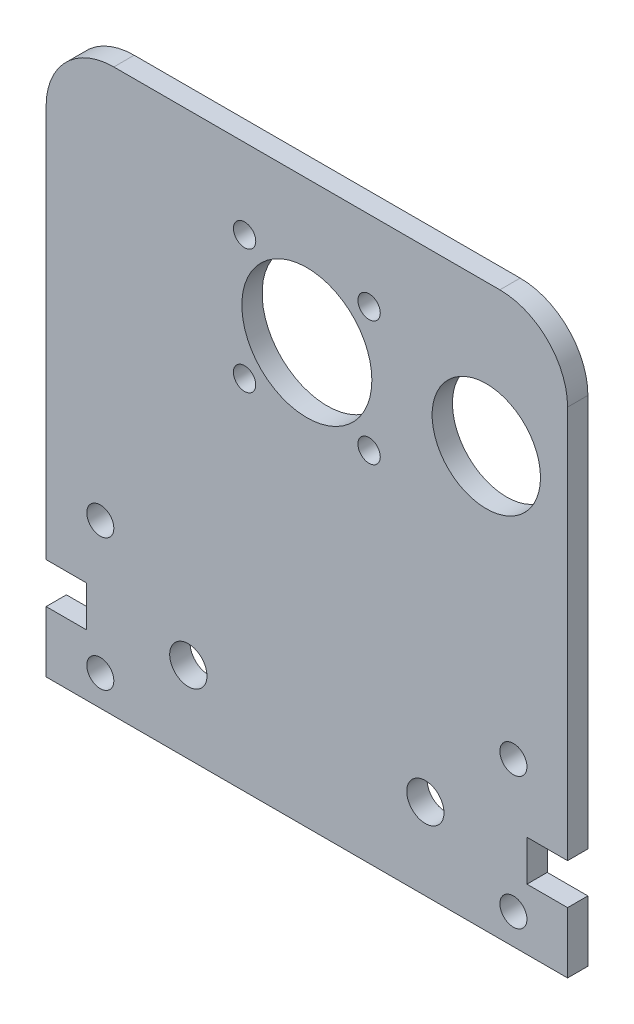
from build123d import *

# Parameters (mm, degrees)
SKETCH1_W           = 77
SKETCH1_H           = 65
BOSS_EXTRUDE1_DEPTH = 3
SKETCH2_R           = 2.75
CUT_EXTRUDE1_DEPTH  = 109.935760887
SKETCH3_R           = 1.65
SKETCH3_R_2         = 9.6
CUT_EXTRUDE2_DEPTH  = 109.935760887
FILLET1_R           = 10
SKETCH4_W           = 77
SKETCH4_H           = 6
BOSS_EXTRUDE2_DEPTH = 3
SKETCH5_R           = 2
CUT_EXTRUDE3_DEPTH  = 109.935760887
SKETCH6_R           = 8
SKETCH6_R_2         = 2.5
CUT_EXTRUDE4_DEPTH  = 109.935760887


with BuildPart() as part:
    # Sketch1 → Boss-Extrude1 (new body)
    with BuildSketch(Plane.XY):
        with Locations((38.5, 44.5)):
            Rectangle(SKETCH1_W, SKETCH1_H)
        Polygon((77, 12), (38.5, 12), (38.5, 0), (77, 0), (77, 3), (71, 3), (71, 9), (77, 9), align=None)
        Polygon((38.5, 0), (38.5, 12), (0, 12), (0, 9), (6, 9), (6, 3), (0, 3), (0, 0), align=None)
    extrude(amount=BOSS_EXTRUDE1_DEPTH)

    # Sketch2 → Cut-Extrude1 (cut, through all)
    with BuildSketch(Plane.XY.offset(3)):
        with Locations((21, 6)):
            Circle(SKETCH2_R)
        with Locations((56, 6)):
            Circle(SKETCH2_R)
    extrude(amount=-CUT_EXTRUDE1_DEPTH, mode=Mode.SUBTRACT)

    # Sketch3 → Cut-Extrude2 (cut, through all)
    with BuildSketch(Plane.XY.offset(3)):
        with Locations((29.307611845, 46.807611845)):
            Circle(SKETCH3_R)
        with Locations((47.692388155, 46.807611845)):
            Circle(SKETCH3_R)
        with Locations((47.692388155, 65.192388155)):
            Circle(SKETCH3_R)
        with Locations((29.307611845, 65.192388155)):
            Circle(SKETCH3_R)
        with Locations((38.5, 56)):
            Circle(SKETCH3_R_2)
    extrude(amount=-CUT_EXTRUDE2_DEPTH, mode=Mode.SUBTRACT)

    # Fillet1
    fillet1_edges = [part.edges().sort_by_distance(p)[0] for p in [
        (0, 77, 1.5),
        (77, 77, 1.5),
    ]]
    fillet(fillet1_edges, radius=FILLET1_R)

    # Sketch4 → Boss-Extrude2 (add)
    with BuildSketch(Plane.XY.offset(3)):
        with Locations((38.5, -3)):
            Rectangle(SKETCH4_W, SKETCH4_H)
    extrude(amount=-BOSS_EXTRUDE2_DEPTH)

    # Sketch5 → Cut-Extrude3 (cut, through all)
    with BuildSketch(Plane.XY.offset(3)):
        with Locations((8, -1.5)):
            Circle(SKETCH5_R)
        with Locations((69, -1.5)):
            Circle(SKETCH5_R)
        with Locations((8, 18)):
            Circle(SKETCH5_R)
        with Locations((69, 18)):
            Circle(SKETCH5_R)
    extrude(amount=-CUT_EXTRUDE3_DEPTH, mode=Mode.SUBTRACT)

    # Sketch6 → Cut-Extrude4 (cut, through all)
    # profile 1 of 2: a face of its own
    with BuildSketch(Plane.XY.offset(3)):
        with Locations((65, 56)):
            Circle(SKETCH6_R)
        with Locations((65, 56)):
            Circle(SKETCH6_R_2, mode=Mode.SUBTRACT)
    # profile 2 of 2: a face of its own
    with BuildSketch(Plane.XY.offset(3)):
        with Locations((65, 56)):
            Circle(SKETCH6_R_2)
    extrude(amount=-CUT_EXTRUDE4_DEPTH, mode=Mode.SUBTRACT)


solid = part.part
